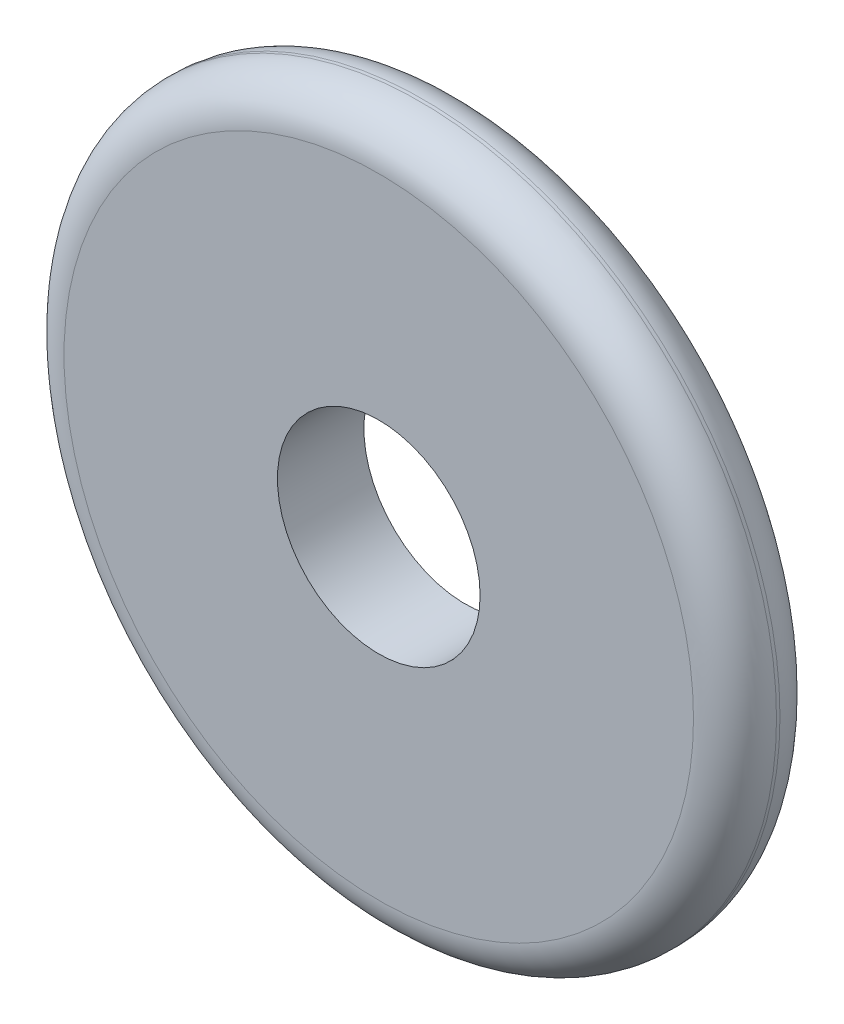
from build123d import *

# Parameters (mm, degrees)
ESQUISSE1_R        = 51.5
ESQUISSE1_R_2      = 14.65
BOSS_EXTRU_1_DEPTH = 12.5
CONG_1_R           = 6


with BuildPart() as part:
    # Esquisse1 → Boss.-Extru.1 (new body)
    with BuildSketch(Plane.XY):
        Circle(ESQUISSE1_R)
        Circle(ESQUISSE1_R_2, mode=Mode.SUBTRACT)
    extrude(amount=BOSS_EXTRU_1_DEPTH)

    # Congé1
    cong_1_edges = [part.edges().sort_by_distance(p)[0] for p in [
        (-51.5, 0, 0),
        (-51.5, 0, 12.5),
    ]]
    fillet(cong_1_edges, radius=CONG_1_R)


solid = part.part
